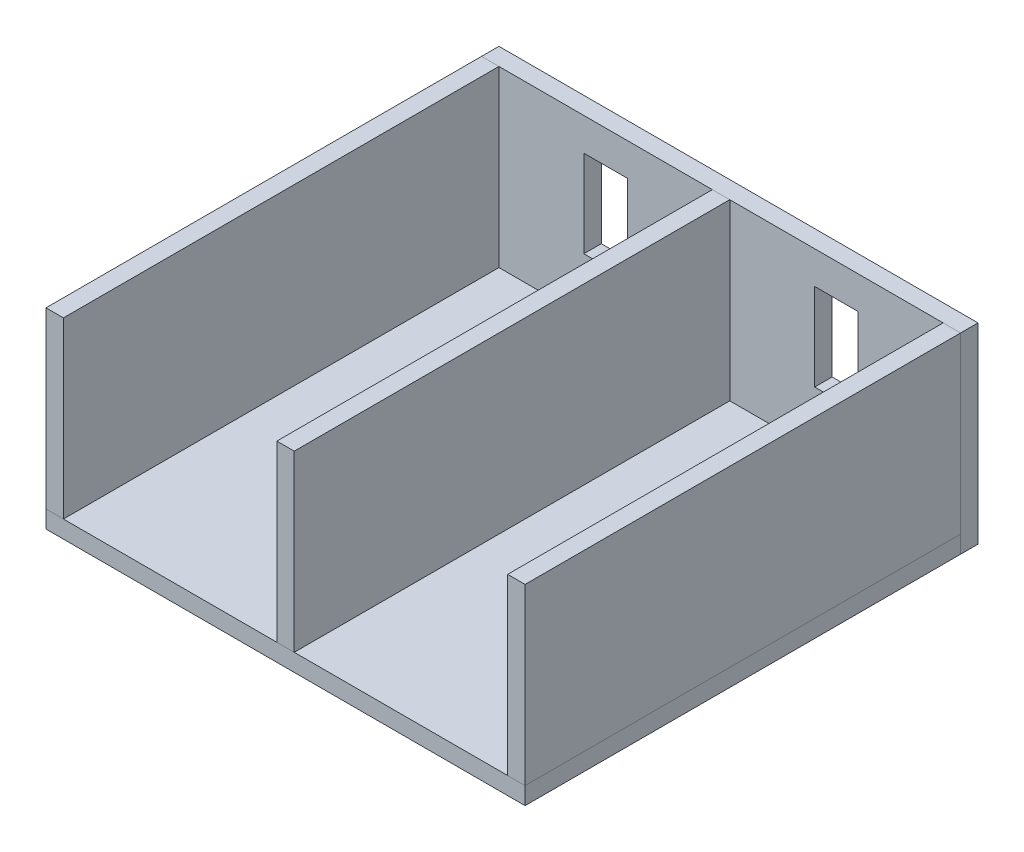
from build123d import *

# Parameters (mm, degrees)
SKETCH1_W             = 220
SKETCH1_H             = 200
BOSS_EXTRUDE1_DEPTH   = 8
SKETCH2_W             = 8
SKETCH2_H             = 200
BOSS_EXTRUDE2_DEPTH   = 80
BOSS_EXTRUDE2_2_DEPTH = 80
BOSS_EXTRUDE2_3_DEPTH = 80
SKETCH3_W             = 220
SKETCH3_H             = 88
BOSS_EXTRUDE3_DEPTH   = 8
SKETCH4_W             = 20
SKETCH4_H             = 40
CUT_EXTRUDE1_DEPTH    = 252.213056985


with BuildPart() as part:
    # Sketch1 → Boss-Extrude1 (new body)
    with BuildSketch(Plane(origin=(0, 0, 0), x_dir=(1, 0, 0), z_dir=(0, 1, 0))):
        Rectangle(SKETCH1_W, SKETCH1_H)
    extrude(amount=BOSS_EXTRUDE1_DEPTH)


with BuildPart() as body_2:
    # Sketch2 → Boss-Extrude2 (new body)
    with BuildSketch(Plane(origin=(0, 8, 0), x_dir=(1, 0, 0), z_dir=(0, 1, 0))):
        with Locations((-106, 0)):
            Rectangle(SKETCH2_W, SKETCH2_H)
    extrude(amount=BOSS_EXTRUDE2_DEPTH)


with BuildPart() as body_3:
    # Sketch2 → Boss-Extrude2 2 (new body)
    with BuildSketch(Plane(origin=(0, 8, 0), x_dir=(1, 0, 0), z_dir=(0, 1, 0))):
        with Locations((106, 0)):
            Rectangle(SKETCH2_W, SKETCH2_H)
    extrude(amount=BOSS_EXTRUDE2_2_DEPTH)


with BuildPart() as body_4:
    # Sketch2 → Boss-Extrude2 3 (new body)
    with BuildSketch(Plane(origin=(0, 8, 0), x_dir=(1, 0, 0), z_dir=(0, 1, 0))):
        Rectangle(SKETCH2_W, SKETCH2_H)
    extrude(amount=BOSS_EXTRUDE2_3_DEPTH)


with BuildPart() as body_5:
    # Sketch3 → Boss-Extrude3 (new body)
    with BuildSketch(Plane(origin=(0, 0, -100), x_dir=(-1, 0, 0), z_dir=(0, 0, -1))):
        with Locations((0, 44)):
            Rectangle(SKETCH3_W, SKETCH3_H)
    extrude(amount=BOSS_EXTRUDE3_DEPTH)

    # Sketch4 → Cut-Extrude1 (cut, through all)
    with BuildSketch(Plane(origin=(0, 0, -108), x_dir=(-1, 0, 0), z_dir=(0, 0, -1))):
        with Locations((53, 53)):
            Rectangle(SKETCH4_W, SKETCH4_H)
        with Locations((-53, 53)):
            Rectangle(SKETCH4_W, SKETCH4_H)
    extrude(amount=-CUT_EXTRUDE1_DEPTH, mode=Mode.SUBTRACT)


solid = Compound([part.part, body_2.part, body_3.part, body_4.part, body_5.part])
